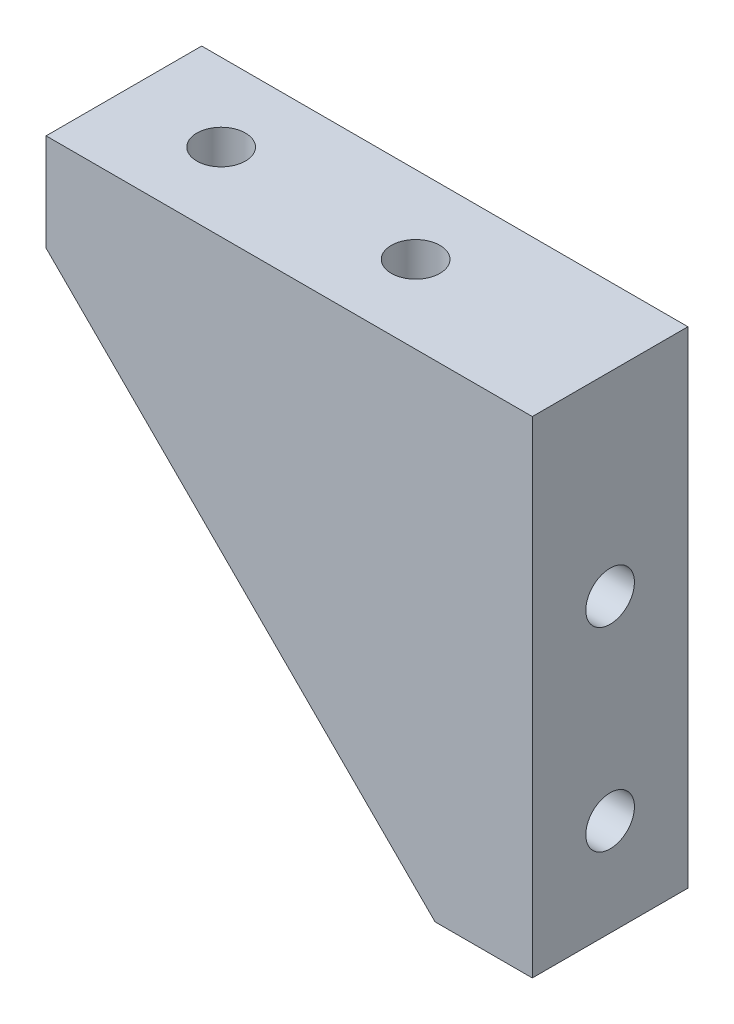
from build123d import *

# Parameters (mm, degrees)
SKETCH_1_W          = 25
SKETCH_1_H          = 25
EXTRUDE_1_DEPTH     = 8
SKETCH_2_R          = 1.25
CUT_EXTRUDE_1_DEPTH = 50
SKETCH_3_R          = 1.25
CUT_EXTRUDE_2_DEPTH = 50
CUT_EXTRUDE_4_DEPTH = 10


with BuildPart() as part:
    # Эскиз1 → Бобышка-Вытянуть1 (new body)
    with BuildSketch(Plane.XY):
        Rectangle(SKETCH_1_W, SKETCH_1_H)
    extrude(amount=EXTRUDE_1_DEPTH)

    # Эскиз2 → Вырез-Вытянуть1 (cut)
    with BuildSketch(Plane(origin=(0, 12.5, 0), x_dir=(1, 0, 0), z_dir=(0, 1, 0))):
        with Locations(Location((-7.5, -4, 0), (0, 0, 270))):
            Circle(SKETCH_2_R)
        with Locations(Location((2.5, -4, 0), (0, 0, 270))):
            Circle(SKETCH_2_R)
    extrude(amount=-CUT_EXTRUDE_1_DEPTH, mode=Mode.SUBTRACT)

    # Эскиз3 → Вырез-Вытянуть2 (cut)
    with BuildSketch(Plane(origin=(12.5, 0, 0), x_dir=(0, 0, -1), z_dir=(1, 0, 0))):
        with Locations(Location((-4, 2.5, 0), (0, 0, 90))):
            Circle(SKETCH_3_R)
        with Locations(Location((-4, -7.5, 0), (0, 0, 90))):
            Circle(SKETCH_3_R)
    extrude(amount=-CUT_EXTRUDE_2_DEPTH, mode=Mode.SUBTRACT)

    # Эскиз4 → Вырез-Вытянуть4 (cut)
    with BuildSketch(Plane(origin=(0, 0, 0), x_dir=(-1, 0, 0), z_dir=(0, 0, -1))):
        Polygon((12.5, 7.5), (-7.5, -12.5), (12.5, -12.5), align=None)
    extrude(amount=-CUT_EXTRUDE_4_DEPTH, mode=Mode.SUBTRACT)


solid = part.part
